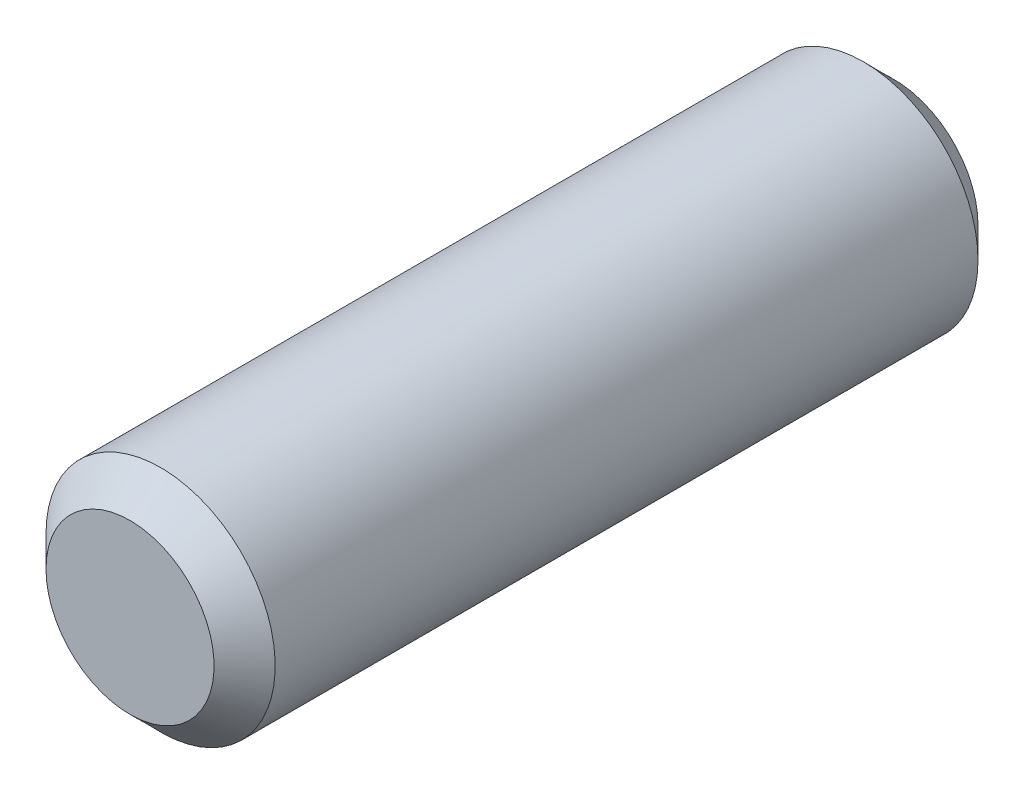
from build123d import *

# Parameters (mm, degrees)
SKETCH1_R           = 1.5
BOSS_EXTRUDE1_DEPTH = 10
CHAMFER1_SIZE       = 0.4


with BuildPart() as part:
    # Sketch1 → Boss-Extrude1 (new body)
    with BuildSketch(Plane.XY):
        Circle(SKETCH1_R)
    extrude(amount=BOSS_EXTRUDE1_DEPTH)

    # Chamfer1
    chamfer1_edges = [part.edges().sort_by_distance(p)[0] for p in [
        (-1.5, 0, 0),
        (-1.5, 0, 10),
    ]]
    chamfer(chamfer1_edges, length=CHAMFER1_SIZE)


solid = part.part
